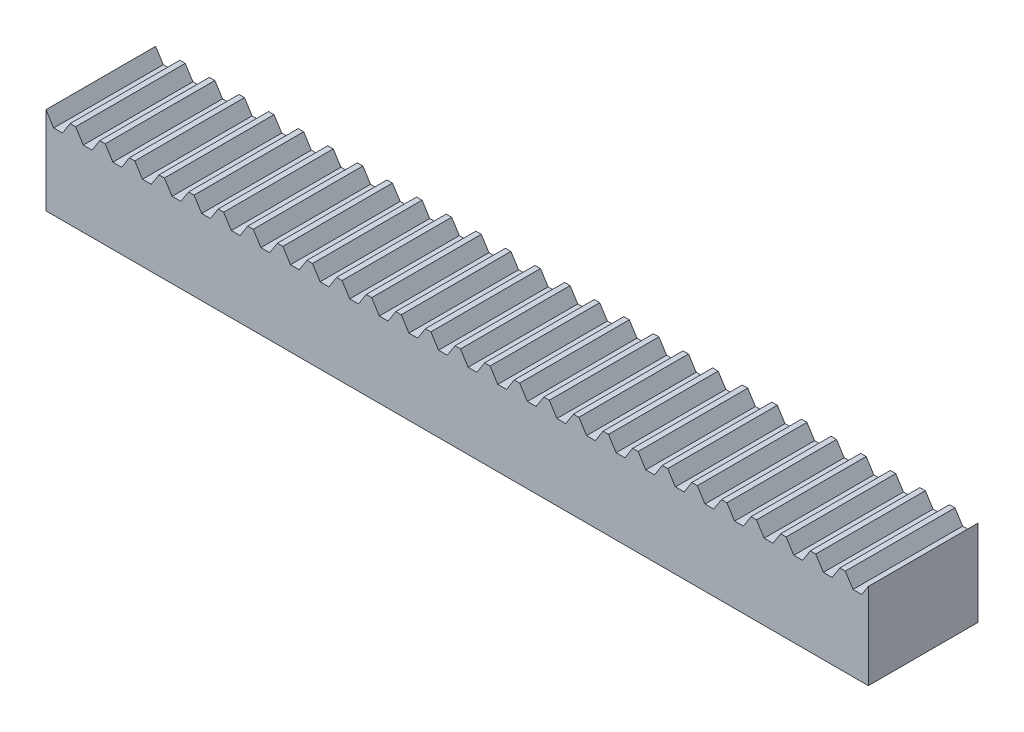
from build123d import *

# Parameters (mm, degrees)
SKETCH2_W           = 75
SKETCH2_H           = 10
BOSS_EXTRUDE1_DEPTH = 8
CUT_EXTRUDE1_DEPTH  = 15
LPATTERN1_COUNT     = 31
LPATTERN1_PITCH     = 2.7


with BuildPart() as part:
    # Sketch2 → Boss-Extrude1 (new body)
    with BuildSketch(Plane(origin=(0, 0, 0), x_dir=(1, 0, 0), z_dir=(0, 1, 0))):
        Rectangle(SKETCH2_W, SKETCH2_H)
    extrude(amount=BOSS_EXTRUDE1_DEPTH)

    # Sketch3 → Cut-Extrude1 (cut)
    with BuildSketch(Plane.XY.offset(5)):
        Polygon((-36.8, 6.9), (-36, 6.9), (-35.3, 8), (-37.5, 8), align=None)
    cut_extrude1 = extrude(amount=-CUT_EXTRUDE1_DEPTH, mode=Mode.SUBTRACT)

    # LPattern1: Cut-Extrude1 ×31
    with Locations(*[(i * LPATTERN1_PITCH, 0, 0) for i in range(1, LPATTERN1_COUNT)]):
        add(cut_extrude1, mode=Mode.SUBTRACT)


solid = part.part
